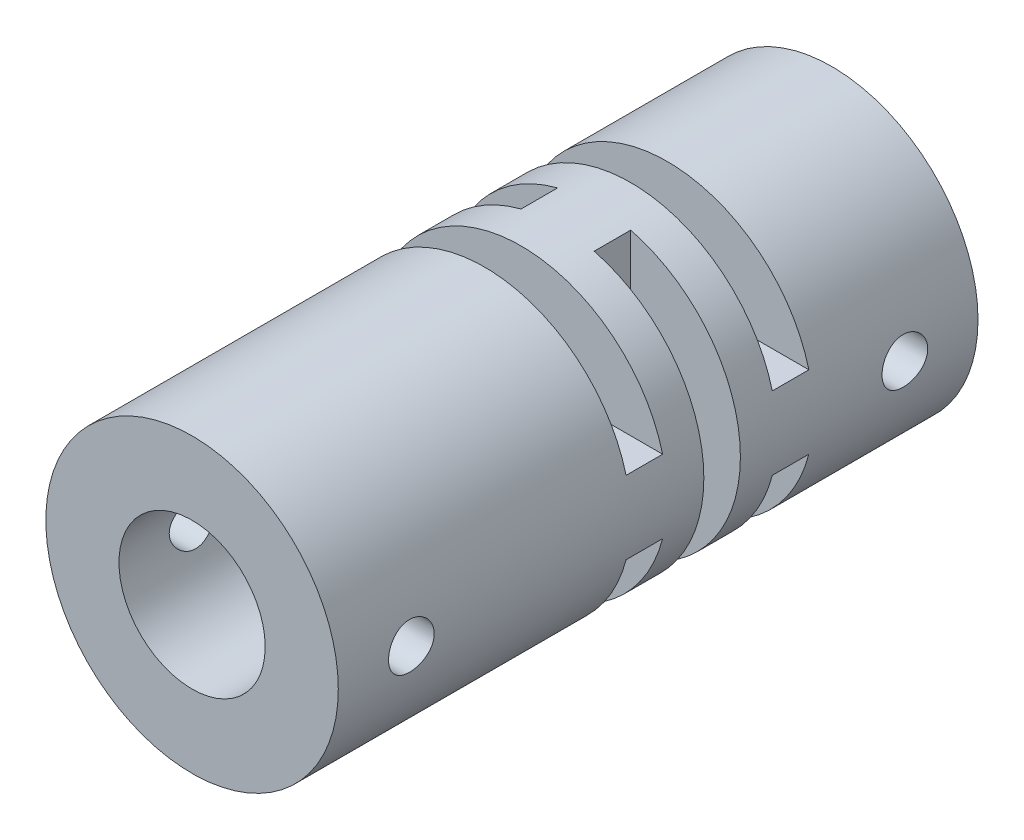
from build123d import *

# Parameters (mm, degrees)
SCHIZZO1_R                           = 8
ESTRUSIONE_ESTRUSIONE1_DEPTH         = 35
SCHIZZO2_R                           = 2.5
TAGLIO_ESTRUSIONE1_DEPTH             = 37.783148315
SCHIZZO3_R                           = 4
TAGLIO_ESTRUSIONE2_DEPTH             = 15
TAGLIO_ESTRUSIONE3_DEPTH             = 37.783148315
TAGLIO_ESTRUSIONE3_DEPTH_BACK        = 37.783148315
SCHIZZO4_R                           = 1.25
TAGLIO_ESTRUSIONE8_REACH             = 38.783
SCHIZZO13_W                          = 2
SCHIZZO13_H                          = 6
TAGLIO_ESTRUSIONE8_DIRECTION_2_REACH = 38.783
TAGLIO_ESTRUSIONE9_REACH             = 38.783
SCHIZZO14_W                          = 6
SCHIZZO14_H                          = 2
TAGLIO_ESTRUSIONE9_DIRECTION_2_REACH = 38.783


with BuildPart() as part:
    # Schizzo1 → Estrusione-Estrusione1 (new body)
    with BuildSketch(Plane.XY):
        Circle(SCHIZZO1_R)
    extrude(amount=ESTRUSIONE_ESTRUSIONE1_DEPTH)

    # Schizzo2 → Taglio-Estrusione1 (cut, through all)
    with BuildSketch(Plane.XY.offset(35)):
        Circle(SCHIZZO2_R)
    extrude(amount=-TAGLIO_ESTRUSIONE1_DEPTH, mode=Mode.SUBTRACT)

    # Schizzo3 → Taglio-Estrusione2 (cut)
    with BuildSketch(Plane.XY.offset(35)):
        Circle(SCHIZZO3_R)
    extrude(amount=-TAGLIO_ESTRUSIONE2_DEPTH, mode=Mode.SUBTRACT)

    # Schizzo4 → Taglio-Estrusione3 (cut, two sides: drawn at the far end of the back side and taken through both)
    with BuildSketch(Plane(origin=(0, 0, 0), x_dir=(0, 0, -1), z_dir=(1, 0, 0)).offset(-TAGLIO_ESTRUSIONE3_DEPTH_BACK)):
        with Locations((-31, 0)):
            Circle(SCHIZZO4_R)
        with Locations((-4, 0)):
            Circle(SCHIZZO4_R)
    extrude(amount=TAGLIO_ESTRUSIONE3_DEPTH + TAGLIO_ESTRUSIONE3_DEPTH_BACK, mode=Mode.SUBTRACT)

    # Schizzo13 → Taglio-Estrusione8 (cut, up to next)
    with BuildSketch(Plane(origin=(0, 0, 0), x_dir=(0, 0, -1), z_dir=(1, 0, 0)), mode=Mode.PRIVATE) as taglio_estrusione8_sk1:
        with Locations((-18, 5)):
            Rectangle(SCHIZZO13_W, SCHIZZO13_H)
    taglio_estrusione8_tool1 = extrude(taglio_estrusione8_sk1.sketch, amount=-TAGLIO_ESTRUSIONE8_REACH, mode=Mode.PRIVATE) & part.part
    # Schizzo13 → Taglio-Estrusione8 (cut, up to next)
    with BuildSketch(Plane(origin=(0, 0, 0), x_dir=(0, 0, -1), z_dir=(1, 0, 0)), mode=Mode.PRIVATE) as taglio_estrusione8_sk2:
        with Locations((-10, 5)):
            Rectangle(SCHIZZO13_W, SCHIZZO13_H)
    taglio_estrusione8_tool2 = extrude(taglio_estrusione8_sk2.sketch, amount=-TAGLIO_ESTRUSIONE8_REACH, mode=Mode.PRIVATE) & part.part
    # Schizzo13 → Taglio-Estrusione8 (cut, up to next)
    with BuildSketch(Plane(origin=(0, 0, 0), x_dir=(0, 0, -1), z_dir=(1, 0, 0)), mode=Mode.PRIVATE) as taglio_estrusione8_sk3:
        with Locations((-18, -5)):
            Rectangle(SCHIZZO13_W, SCHIZZO13_H)
    taglio_estrusione8_tool3 = extrude(taglio_estrusione8_sk3.sketch, amount=-TAGLIO_ESTRUSIONE8_REACH, mode=Mode.PRIVATE) & part.part
    # Schizzo13 → Taglio-Estrusione8 (cut, up to next)
    with BuildSketch(Plane(origin=(0, 0, 0), x_dir=(0, 0, -1), z_dir=(1, 0, 0)), mode=Mode.PRIVATE) as taglio_estrusione8_sk4:
        with Locations((-10, -5)):
            Rectangle(SCHIZZO13_W, SCHIZZO13_H)
    taglio_estrusione8_tool4 = extrude(taglio_estrusione8_sk4.sketch, amount=-TAGLIO_ESTRUSIONE8_REACH, mode=Mode.PRIVATE) & part.part
    add(taglio_estrusione8_tool1.solids().sort_by_distance((0, 5, 18))[0], mode=Mode.SUBTRACT)
    add(taglio_estrusione8_tool2.solids().sort_by_distance((0, 5, 10))[0], mode=Mode.SUBTRACT)
    add(taglio_estrusione8_tool3.solids().sort_by_distance((0, -5, 18))[0], mode=Mode.SUBTRACT)
    add(taglio_estrusione8_tool4.solids().sort_by_distance((0, -5, 10))[0], mode=Mode.SUBTRACT)

    # Schizzo13 → Taglio-Estrusione8 direction 2 (cut, up to next)
    with BuildSketch(Plane(origin=(0, 0, 0), x_dir=(0, 0, -1), z_dir=(1, 0, 0)), mode=Mode.PRIVATE) as taglio_estrusione8_direction_2_sk1:
        with Locations((-18, 5)):
            Rectangle(SCHIZZO13_W, SCHIZZO13_H)
    taglio_estrusione8_direction_2_tool1 = extrude(taglio_estrusione8_direction_2_sk1.sketch, amount=TAGLIO_ESTRUSIONE8_DIRECTION_2_REACH, mode=Mode.PRIVATE) & part.part
    # Schizzo13 → Taglio-Estrusione8 direction 2 (cut, up to next)
    with BuildSketch(Plane(origin=(0, 0, 0), x_dir=(0, 0, -1), z_dir=(1, 0, 0)), mode=Mode.PRIVATE) as taglio_estrusione8_direction_2_sk2:
        with Locations((-10, 5)):
            Rectangle(SCHIZZO13_W, SCHIZZO13_H)
    taglio_estrusione8_direction_2_tool2 = extrude(taglio_estrusione8_direction_2_sk2.sketch, amount=TAGLIO_ESTRUSIONE8_DIRECTION_2_REACH, mode=Mode.PRIVATE) & part.part
    # Schizzo13 → Taglio-Estrusione8 direction 2 (cut, up to next)
    with BuildSketch(Plane(origin=(0, 0, 0), x_dir=(0, 0, -1), z_dir=(1, 0, 0)), mode=Mode.PRIVATE) as taglio_estrusione8_direction_2_sk3:
        with Locations((-18, -5)):
            Rectangle(SCHIZZO13_W, SCHIZZO13_H)
    taglio_estrusione8_direction_2_tool3 = extrude(taglio_estrusione8_direction_2_sk3.sketch, amount=TAGLIO_ESTRUSIONE8_DIRECTION_2_REACH, mode=Mode.PRIVATE) & part.part
    # Schizzo13 → Taglio-Estrusione8 direction 2 (cut, up to next)
    with BuildSketch(Plane(origin=(0, 0, 0), x_dir=(0, 0, -1), z_dir=(1, 0, 0)), mode=Mode.PRIVATE) as taglio_estrusione8_direction_2_sk4:
        with Locations((-10, -5)):
            Rectangle(SCHIZZO13_W, SCHIZZO13_H)
    taglio_estrusione8_direction_2_tool4 = extrude(taglio_estrusione8_direction_2_sk4.sketch, amount=TAGLIO_ESTRUSIONE8_DIRECTION_2_REACH, mode=Mode.PRIVATE) & part.part
    add(taglio_estrusione8_direction_2_tool1.solids().sort_by_distance((0, 5, 18))[0], mode=Mode.SUBTRACT)
    add(taglio_estrusione8_direction_2_tool2.solids().sort_by_distance((0, 5, 10))[0], mode=Mode.SUBTRACT)
    add(taglio_estrusione8_direction_2_tool3.solids().sort_by_distance((0, -5, 18))[0], mode=Mode.SUBTRACT)
    add(taglio_estrusione8_direction_2_tool4.solids().sort_by_distance((0, -5, 10))[0], mode=Mode.SUBTRACT)

    # Schizzo14 → Taglio-Estrusione9 (cut, up to next)
    with BuildSketch(Plane(origin=(0, 0, 0), x_dir=(1, 0, 0), z_dir=(0, 1, 0)), mode=Mode.PRIVATE) as taglio_estrusione9_sk1:
        with Locations((-5, -14)):
            Rectangle(SCHIZZO14_W, SCHIZZO14_H)
    taglio_estrusione9_tool1 = extrude(taglio_estrusione9_sk1.sketch, amount=-TAGLIO_ESTRUSIONE9_REACH, mode=Mode.PRIVATE) & part.part
    # Schizzo14 → Taglio-Estrusione9 (cut, up to next)
    with BuildSketch(Plane(origin=(0, 0, 0), x_dir=(1, 0, 0), z_dir=(0, 1, 0)), mode=Mode.PRIVATE) as taglio_estrusione9_sk2:
        with Locations((5, -14)):
            Rectangle(SCHIZZO14_W, SCHIZZO14_H)
    taglio_estrusione9_tool2 = extrude(taglio_estrusione9_sk2.sketch, amount=-TAGLIO_ESTRUSIONE9_REACH, mode=Mode.PRIVATE) & part.part
    add(taglio_estrusione9_tool1.solids().sort_by_distance((-5, 0, 14))[0], mode=Mode.SUBTRACT)
    add(taglio_estrusione9_tool2.solids().sort_by_distance((5, 0, 14))[0], mode=Mode.SUBTRACT)

    # Schizzo14 → Taglio-Estrusione9 direction 2 (cut, up to next)
    with BuildSketch(Plane(origin=(0, 0, 0), x_dir=(1, 0, 0), z_dir=(0, 1, 0)), mode=Mode.PRIVATE) as taglio_estrusione9_direction_2_sk1:
        with Locations((-5, -14)):
            Rectangle(SCHIZZO14_W, SCHIZZO14_H)
    taglio_estrusione9_direction_2_tool1 = extrude(taglio_estrusione9_direction_2_sk1.sketch, amount=TAGLIO_ESTRUSIONE9_DIRECTION_2_REACH, mode=Mode.PRIVATE) & part.part
    # Schizzo14 → Taglio-Estrusione9 direction 2 (cut, up to next)
    with BuildSketch(Plane(origin=(0, 0, 0), x_dir=(1, 0, 0), z_dir=(0, 1, 0)), mode=Mode.PRIVATE) as taglio_estrusione9_direction_2_sk2:
        with Locations((5, -14)):
            Rectangle(SCHIZZO14_W, SCHIZZO14_H)
    taglio_estrusione9_direction_2_tool2 = extrude(taglio_estrusione9_direction_2_sk2.sketch, amount=TAGLIO_ESTRUSIONE9_DIRECTION_2_REACH, mode=Mode.PRIVATE) & part.part
    add(taglio_estrusione9_direction_2_tool1.solids().sort_by_distance((-5, 0, 14))[0], mode=Mode.SUBTRACT)
    add(taglio_estrusione9_direction_2_tool2.solids().sort_by_distance((5, 0, 14))[0], mode=Mode.SUBTRACT)


solid = part.part
